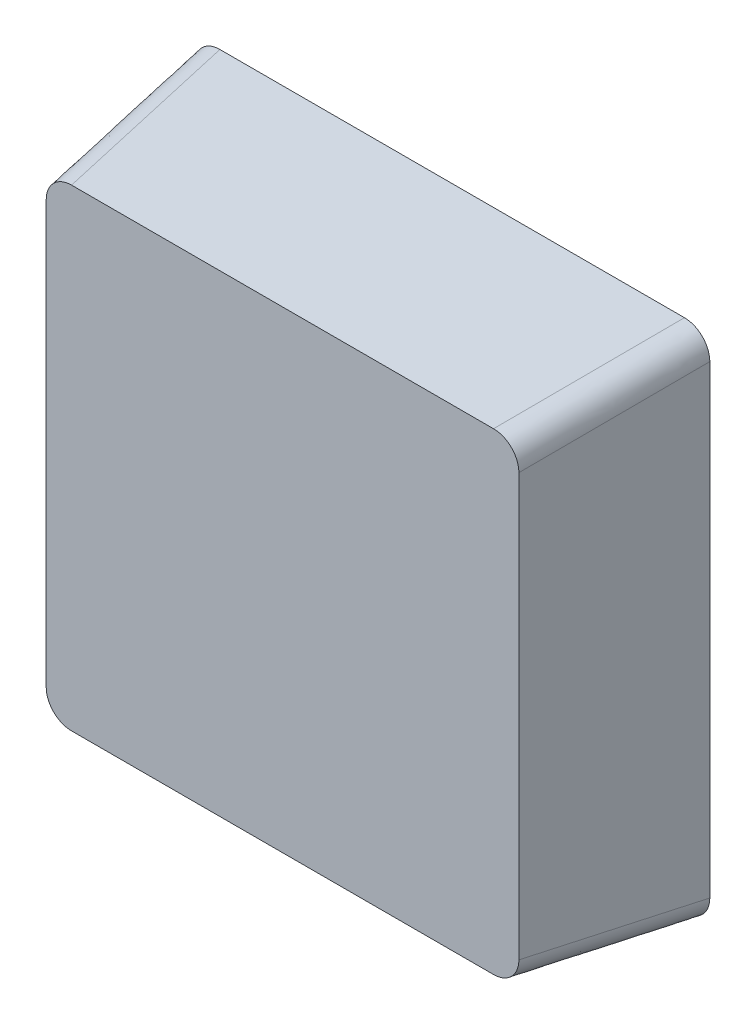
from build123d import *

# Parameters (mm, degrees)
ESQUISSE3_W                       = 44
ESQUISSE3_H                       = 6
ENL_V_MAT_EXTRU_3_DEPTH           = 15
ENL_V_MAT_EXTRU_3_DRAFT           = 1
ENL_V_MAT_EXTRU_3_PROFILE_2_DEPTH = 15
ENL_V_MAT_EXTRU_3_PROFILE_2_DRAFT = 1
ENL_V_MAT_EXTRU_3_PROFILE_3_DEPTH = 15
ENL_V_MAT_EXTRU_3_PROFILE_3_DRAFT = 1
ENL_V_MAT_EXTRU_3_PROFILE_4_DEPTH = 15
ENL_V_MAT_EXTRU_3_PROFILE_4_DRAFT = 1
CONG_1_R                          = 3


with BuildPart() as part:
    # Esquisse1 → Lissage1 section 0
    with BuildSketch(Plane.XY):
        with BuildLine():
            Line((-27.75, 27.75), (27.75, 27.75))
            Line((27.75, 27.75), (27.75, -27.75))
            Line((27.75, -27.75), (-27.75, -27.75))
            Line((-27.75, -27.75), (-27.75, 27.75))
        make_face()
    # Esquisse2 → Lissage1 section 1
    with BuildSketch(Plane.XY.offset(-20)):
        with BuildLine():
            Line((-30.33229437, 30.25), (30.16770563, 30.249999987))
            Line((30.16770563, 30.249999987), (30.166474554, -30.25))
            Line((30.166474554, -30.25), (-30.333525446, -30.25))
            Line((-30.333525446, -30.25), (-30.33229437, 30.25))
        make_face()
    loft()


with BuildPart() as enl_v_mat_extru_3_tool:
    # Esquisse3 → Enlèv. mat.-Extru.3 (with draft: the straight prism first)
    with BuildSketch(Plane.XY.offset(-20)):
        with Locations((0, -6.65)):
            Rectangle(ESQUISSE3_W, ESQUISSE3_H)
    extrude(amount=ENL_V_MAT_EXTRU_3_DEPTH)
    # Enlèv. mat.-Extru.3: the draft: its side faces are tilted about the plane it starts from
    enl_v_mat_extru_3_sides = [enl_v_mat_extru_3_tool.faces().sort_by_distance(p)[0] for p in [
        (0, -9.65, -12.5),
        (22, -6.65, -12.5),
        (0, -3.65, -12.5),
        (-22, -6.65, -12.5),
    ]]
    draft(enl_v_mat_extru_3_sides, Plane.XY.offset(-20), ENL_V_MAT_EXTRU_3_DRAFT)


with BuildPart() as part_1:
    add(part.part)

    # Enlèv. mat.-Extru.3: cut by enl_v_mat_extru_3_tool
    add(enl_v_mat_extru_3_tool.part, mode=Mode.SUBTRACT)


with BuildPart() as enl_v_mat_extru_3_profile_2_tool:
    # Esquisse3 → Enlèv. mat.-Extru.3 profile 2 (with draft: the straight prism first)
    with BuildSketch(Plane.XY.offset(-20)):
        with Locations((0, -19.95)):
            Rectangle(ESQUISSE3_W, ESQUISSE3_H)
    extrude(amount=ENL_V_MAT_EXTRU_3_PROFILE_2_DEPTH)
    # Enlèv. mat.-Extru.3 profile 2: the draft: its side faces are tilted about the plane it starts from
    enl_v_mat_extru_3_profile_2_sides = [enl_v_mat_extru_3_profile_2_tool.faces().sort_by_distance(p)[0] for p in [
        (0, -22.95, -12.5),
        (22, -19.95, -12.5),
        (0, -16.95, -12.5),
        (-22, -19.95, -12.5),
    ]]
    draft(enl_v_mat_extru_3_profile_2_sides, Plane.XY.offset(-20), ENL_V_MAT_EXTRU_3_PROFILE_2_DRAFT)


with BuildPart() as part_2:
    add(part_1.part)

    # Enlèv. mat.-Extru.3 profile 2: cut by enl_v_mat_extru_3_profile_2_tool
    add(enl_v_mat_extru_3_profile_2_tool.part, mode=Mode.SUBTRACT)


with BuildPart() as enl_v_mat_extru_3_profile_3_tool:
    # Esquisse3 → Enlèv. mat.-Extru.3 profile 3 (with draft: the straight prism first)
    with BuildSketch(Plane.XY.offset(-20)):
        with Locations((0, 6.65)):
            Rectangle(ESQUISSE3_W, ESQUISSE3_H)
    extrude(amount=ENL_V_MAT_EXTRU_3_PROFILE_3_DEPTH)
    # Enlèv. mat.-Extru.3 profile 3: the draft: its side faces are tilted about the plane it starts from
    enl_v_mat_extru_3_profile_3_sides = [enl_v_mat_extru_3_profile_3_tool.faces().sort_by_distance(p)[0] for p in [
        (0, 3.65, -12.5),
        (22, 6.65, -12.5),
        (0, 9.65, -12.5),
        (-22, 6.65, -12.5),
    ]]
    draft(enl_v_mat_extru_3_profile_3_sides, Plane.XY.offset(-20), ENL_V_MAT_EXTRU_3_PROFILE_3_DRAFT)


with BuildPart() as part_3:
    add(part_2.part)

    # Enlèv. mat.-Extru.3 profile 3: cut by enl_v_mat_extru_3_profile_3_tool
    add(enl_v_mat_extru_3_profile_3_tool.part, mode=Mode.SUBTRACT)


with BuildPart() as enl_v_mat_extru_3_profile_4_tool:
    # Esquisse3 → Enlèv. mat.-Extru.3 profile 4 (with draft: the straight prism first)
    with BuildSketch(Plane.XY.offset(-20)):
        with Locations((0, 19.95)):
            Rectangle(ESQUISSE3_W, ESQUISSE3_H)
    extrude(amount=ENL_V_MAT_EXTRU_3_PROFILE_4_DEPTH)
    # Enlèv. mat.-Extru.3 profile 4: the draft: its side faces are tilted about the plane it starts from
    enl_v_mat_extru_3_profile_4_sides = [enl_v_mat_extru_3_profile_4_tool.faces().sort_by_distance(p)[0] for p in [
        (0, 16.95, -12.5),
        (22, 19.95, -12.5),
        (0, 22.95, -12.5),
        (-22, 19.95, -12.5),
    ]]
    draft(enl_v_mat_extru_3_profile_4_sides, Plane.XY.offset(-20), ENL_V_MAT_EXTRU_3_PROFILE_4_DRAFT)


with BuildPart() as part_4:
    add(part_3.part)

    # Enlèv. mat.-Extru.3 profile 4: cut by enl_v_mat_extru_3_profile_4_tool
    add(enl_v_mat_extru_3_profile_4_tool.part, mode=Mode.SUBTRACT)

    # Congé1
    cong_1_edges = [part_4.edges().sort_by_distance(p)[0] for p in [
        (-29.041147185, 29, -10),
        (-29.041762723, -29, -10),
        (28.958852815, 28.999999994, -10),
        (28.958237277, -29, -10),
    ]]
    fillet(cong_1_edges, radius=CONG_1_R)


solid = part_4.part
